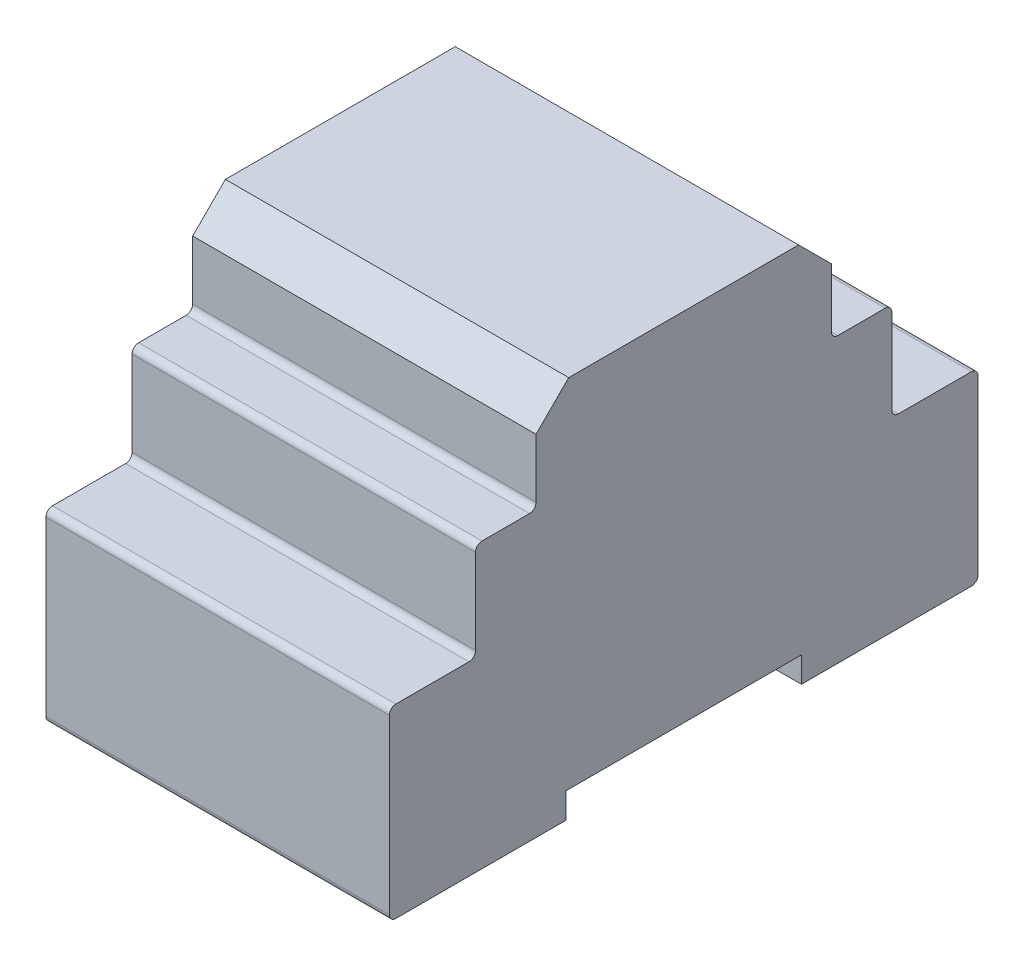
from build123d import *

# Parameters (mm, degrees)
SKETCH_1_W          = 52.5
SKETCH_1_H          = 90
EXTRUDE_1_DEPTH     = 58.4
SKETCH_3_W          = 52.5
SKETCH_3_H          = 22.425
CUT_EXTRUDE_1_DEPTH = 15
SKETCH_4_W          = 52.5
SKETCH_4_H          = 13.18
SKETCH_4_H_2        = 13.17
CUT_EXTRUDE_2_DEPTH = 15
CHAMFER_1_SIZE      = 5
SKETCH_5_W          = 52.5
SKETCH_5_H          = 36
CUT_EXTRUDE_3_DEPTH = 3.9
FILLET_1_R          = 1


with BuildPart() as part:
    # Эскиз1 → Бобышка-Вытянуть1 (new body)
    with BuildSketch(Plane(origin=(0, 0, 0), x_dir=(1, 0, 0), z_dir=(0, 1, 0))):
        with Locations((26.25, 45)):
            Rectangle(SKETCH_1_W, SKETCH_1_H)
    extrude(amount=EXTRUDE_1_DEPTH)

    # Эскиз3 → Вырез-Вытянуть1 (cut)
    with BuildSketch(Plane(origin=(0, 58.4, 0), x_dir=(1, 0, 0), z_dir=(0, 1, 0))):
        with Locations((26.25, 78.7875)):
            Rectangle(SKETCH_3_W, SKETCH_3_H)
        with Locations((26.25, 11.2125)):
            Rectangle(SKETCH_3_W, SKETCH_3_H)
    extrude(amount=-CUT_EXTRUDE_1_DEPTH, mode=Mode.SUBTRACT)

    # Эскиз4 → Вырез-Вытянуть2 (cut)
    with BuildSketch(Plane(origin=(0, 43.4, 0), x_dir=(1, 0, 0), z_dir=(0, 1, 0))):
        with Locations((26.25, 83.41)):
            Rectangle(SKETCH_4_W, SKETCH_4_H)
        with Locations((26.25, 6.585)):
            Rectangle(SKETCH_4_W, SKETCH_4_H_2)
    extrude(amount=-CUT_EXTRUDE_2_DEPTH, mode=Mode.SUBTRACT)

    # Фаска1
    chamfer_1_edges = [part.edges().sort_by_distance(p)[0] for p in [
        (26.25, 58.4, -67.575),
        (26.25, 58.4, -22.425),
    ]]
    chamfer(chamfer_1_edges, length=CHAMFER_1_SIZE)

    # Эскиз5 → Вырез-Вытянуть3 (cut)
    with BuildSketch(Plane.XZ):
        with Locations((26.25, -45)):
            Rectangle(SKETCH_5_W, SKETCH_5_H)
    extrude(amount=-CUT_EXTRUDE_3_DEPTH, mode=Mode.SUBTRACT)

    # Скругление1
    fillet_1_edges = [part.edges().sort_by_distance(p)[0] for p in [
        (26.25, 43.4, -67.575),
        (26.25, 43.4, -22.425),
        (26.25, 0, -90),
        (26.25, 28.4, -90),
        (26.25, 28.4, -76.82),
        (26.25, 43.4, -76.82),
        (26.25, 0, 0),
        (26.25, 28.4, -13.17),
        (26.25, 28.4, 0),
        (26.25, 43.4, -13.17),
    ]]
    fillet(fillet_1_edges, radius=FILLET_1_R)


solid = part.part
